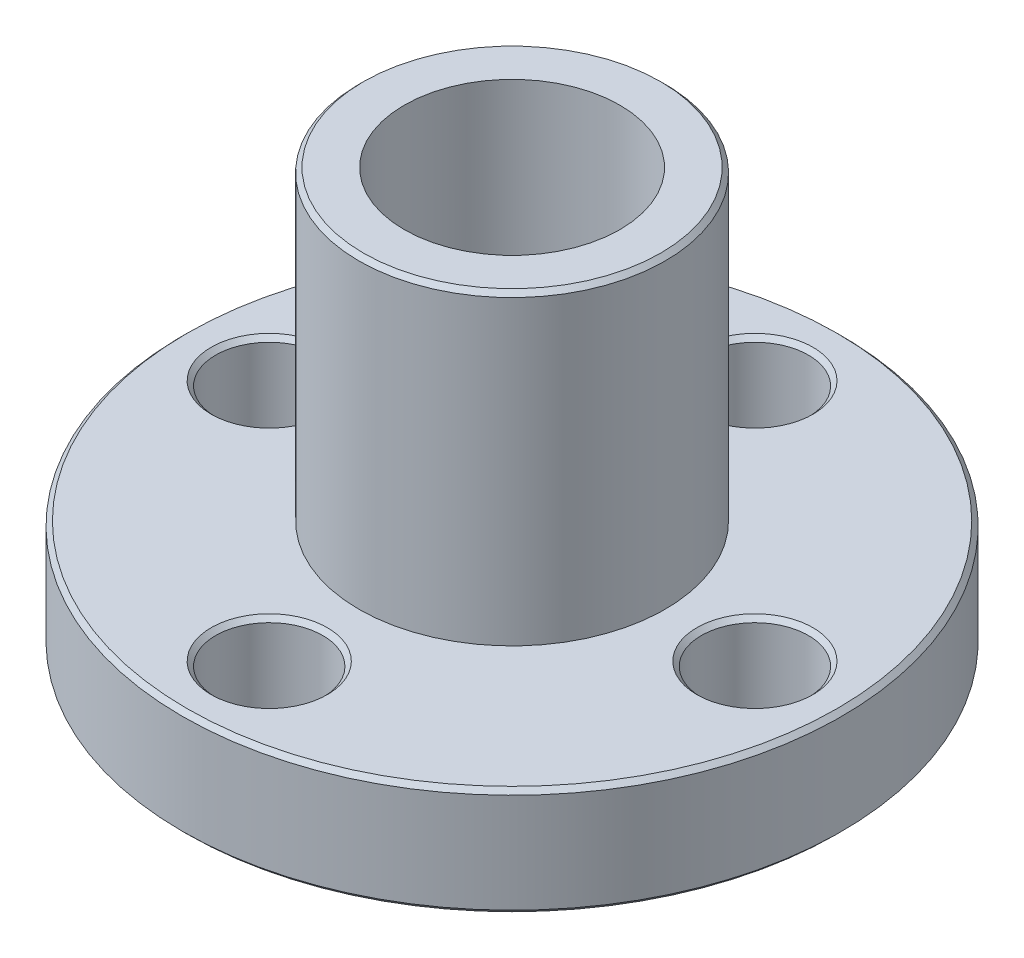
from build123d import *

# Parameters (mm, degrees)
CROQUIS1_R              = 10.925
SALIENTE_EXTRUIR1_DEPTH = 3.6
CROQUIS2_R              = 1.775
CORTAR_EXTRUIR1_DEPTH   = 3.6
CROQUIS3_R              = 5.075
SALIENTE_EXTRUIR2_DEPTH = 10.15
SALIENTE_EXTRUIR3_START = 1.5
CROQUIS4_R              = 5.075
SALIENTE_EXTRUIR3_DEPTH = 1.5
CROQUIS5_R              = 3.575
CORTAR_EXTRUIR2_DEPTH   = 31.5
CHAFL_N1_SIZE           = 0.15


with BuildPart() as part:
    # Croquis1 → Saliente-Extruir1 (new body)
    with BuildSketch(Plane(origin=(0, 0, 0), x_dir=(1, 0, 0), z_dir=(0, 1, 0))):
        with Locations(Location((0, 0, 0), (0, 0, 270))):
            Circle(CROQUIS1_R)
    extrude(amount=SALIENTE_EXTRUIR1_DEPTH)

    # Croquis2 → Cortar-Extruir1 (cut)
    with BuildSketch(Plane(origin=(0, 3.6, 0), x_dir=(1, 0, 0), z_dir=(0, 1, 0))):
        with Locations(Location((-8.05, 0, 0), (0, 0, 270))):
            Circle(CROQUIS2_R)
        with Locations(Location((8.05, 0, 0), (0, 0, 270))):
            Circle(CROQUIS2_R)
        with Locations(Location((0, -8.05, 0), (0, 0, 270))):
            Circle(CROQUIS2_R)
        with Locations(Location((0, 8.05, 0), (0, 0, 270))):
            Circle(CROQUIS2_R)
    extrude(amount=-CORTAR_EXTRUIR1_DEPTH, mode=Mode.SUBTRACT)

    # Croquis3 → Saliente-Extruir2 (add)
    with BuildSketch(Plane(origin=(0, 3.6, 0), x_dir=(1, 0, 0), z_dir=(0, 1, 0))):
        with Locations(Location((0, 0, 0), (0, 0, 270))):
            Circle(CROQUIS3_R)
    extrude(amount=SALIENTE_EXTRUIR2_DEPTH)

    # Croquis4 → Saliente-Extruir3 (add)
    with BuildSketch(Plane.XZ.offset(SALIENTE_EXTRUIR3_START)):
        with Locations(Location((0, 0, 0), (0, 0, 90))):
            Circle(CROQUIS4_R)
    extrude(amount=-SALIENTE_EXTRUIR3_DEPTH)

    # Croquis5 → Cortar-Extruir2 (cut)
    with BuildSketch(Plane.XZ.offset(1.5)):
        with Locations(Location((0, 0, 0), (0, 0, 270))):
            Circle(CROQUIS5_R)
    extrude(amount=-CORTAR_EXTRUIR2_DEPTH, mode=Mode.SUBTRACT)

    # Chaflán1
    chafl_n1_edges = [part.edges().sort_by_distance(p)[0] for p in [
        (8.05, 0, -1.775),
        (8.05, 3.6, -1.775),
        (0, 0, 6.275),
        (0, 3.6, 6.275),
        (0, 0, -9.825),
        (0, 3.6, -9.825),
        (0, 0, -10.925),
        (0, 13.75, -5.075),
        (0, -1.5, -5.075),
        (0, 3.6, -10.925),
        (-8.05, 0, -1.775),
        (-8.05, 3.6, -1.775),
    ]]
    chamfer(chafl_n1_edges, length=CHAFL_N1_SIZE)


solid = part.part
